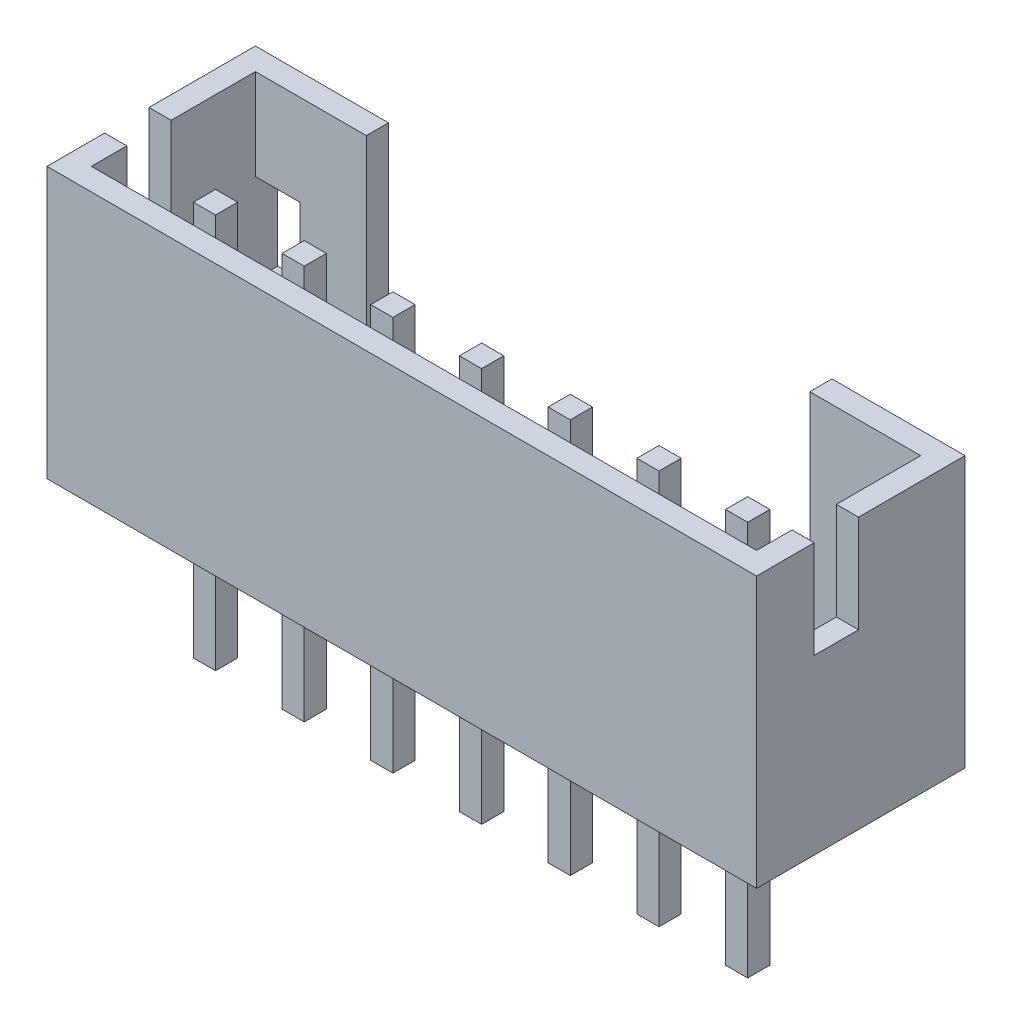
from build123d import *

# Parameters (mm, degrees)
SKETCH1_W         = 16
SKETCH1_H         = 4.7
CASING_DEPTH      = 6.1
CASING_SHELL_T    = -0.5
PINS_DEPTH        = 5
PINS_DEPTH_BACK   = 3.9
SKETCH2_W         = 0.5
SKETCH2_H         = 0.5
PINS_2_DEPTH      = 5
PINS_2_DEPTH_BACK = 3.9
PINS_3_DEPTH      = 5
PINS_3_DEPTH_BACK = 3.9
PINS_4_DEPTH      = 5
PINS_4_DEPTH_BACK = 3.9
PINS_5_DEPTH      = 5
PINS_5_DEPTH_BACK = 3.9
PINS_6_DEPTH      = 5
PINS_6_DEPTH_BACK = 3.9
PINS_7_DEPTH      = 5
PINS_7_DEPTH_BACK = 3.9
SKETCH3_W         = 10
SKETCH3_H         = 4.6
SKETCH3_W_2       = 1
SKETCH3_H_2       = 2
SHAPE_CUT1_DEPTH  = 0.5
SKETCH4_W         = 1
SKETCH4_H         = 2.2
SHAPE_CUT2_DEPTH  = 15.5


with BuildPart() as part:
    # Sketch1 → casing (new body)
    with BuildSketch(Plane(origin=(0, 0, 0), x_dir=(1, 0, 0), z_dir=(0, 1, 0))):
        Rectangle(SKETCH1_W, SKETCH1_H)
    extrude(amount=CASING_DEPTH)

    # casing_shell
    casing_shell_openings = [part.faces().sort_by_distance(p)[0] for p in [
        (0, 6.1, 0),
    ]]
    offset(amount=CASING_SHELL_T, openings=casing_shell_openings, kind=Kind.INTERSECTION)

    # Sketch3 → shape_cut1 (cut)
    with BuildSketch(Plane(origin=(0, 0, -2.35), x_dir=(-1, 0, 0), z_dir=(0, 0, -1))):
        with Locations((0, 3.8)):
            Rectangle(SKETCH3_W, SKETCH3_H)
        with Locations((-7, 3.05)):
            Rectangle(SKETCH3_W_2, SKETCH3_H_2)
        with Locations((7, 3.05)):
            Rectangle(SKETCH3_W_2, SKETCH3_H_2)
    extrude(amount=-SHAPE_CUT1_DEPTH, mode=Mode.SUBTRACT)

    # Sketch4 → shape_cut2 (cut)
    with BuildSketch(Plane.ZY.offset(8)):
        with Locations((0.55, 5)):
            Rectangle(SKETCH4_W, SKETCH4_H)
    shape_cut2 = extrude(amount=-SHAPE_CUT2_DEPTH, mode=Mode.SUBTRACT)

    # shape_cut2m: shape_cut2 across plane
    add(shape_cut2.mirror(Plane(origin=(0, 0, 0), x_dir=(0, 0, 1), z_dir=(1, 0, 0))), mode=Mode.SUBTRACT)


with BuildPart() as body_2:
    # Sketch2 → pins (new, two sides: drawn at the far end of the back side and taken through both)
    with BuildSketch(Plane(origin=(0, 0.5, 0), x_dir=(1, 0, 0), z_dir=(0, 1, 0)).offset(-PINS_DEPTH_BACK)):
        with Locations((-6, -0.55)):
            Rectangle(SKETCH2_W, SKETCH2_H)
    extrude(amount=PINS_DEPTH + PINS_DEPTH_BACK)


with BuildPart() as body_3:
    # Sketch2 → pins 2 (new, two sides: drawn at the far end of the back side and taken through both)
    with BuildSketch(Plane(origin=(0, 0.5, 0), x_dir=(1, 0, 0), z_dir=(0, 1, 0)).offset(-PINS_2_DEPTH_BACK)):
        with Locations((-4, -0.55)):
            Rectangle(SKETCH2_W, SKETCH2_H)
    extrude(amount=PINS_2_DEPTH + PINS_2_DEPTH_BACK)


with BuildPart() as body_4:
    # Sketch2 → pins 3 (new, two sides: drawn at the far end of the back side and taken through both)
    with BuildSketch(Plane(origin=(0, 0.5, 0), x_dir=(1, 0, 0), z_dir=(0, 1, 0)).offset(-PINS_3_DEPTH_BACK)):
        with Locations((-2, -0.55)):
            Rectangle(SKETCH2_W, SKETCH2_H)
    extrude(amount=PINS_3_DEPTH + PINS_3_DEPTH_BACK)


with BuildPart() as body_5:
    # Sketch2 → pins 4 (new, two sides: drawn at the far end of the back side and taken through both)
    with BuildSketch(Plane(origin=(0, 0.5, 0), x_dir=(1, 0, 0), z_dir=(0, 1, 0)).offset(-PINS_4_DEPTH_BACK)):
        with Locations((0, -0.55)):
            Rectangle(SKETCH2_W, SKETCH2_H)
    extrude(amount=PINS_4_DEPTH + PINS_4_DEPTH_BACK)


with BuildPart() as body_6:
    # Sketch2 → pins 5 (new, two sides: drawn at the far end of the back side and taken through both)
    with BuildSketch(Plane(origin=(0, 0.5, 0), x_dir=(1, 0, 0), z_dir=(0, 1, 0)).offset(-PINS_5_DEPTH_BACK)):
        with Locations((2, -0.55)):
            Rectangle(SKETCH2_W, SKETCH2_H)
    extrude(amount=PINS_5_DEPTH + PINS_5_DEPTH_BACK)


with BuildPart() as body_7:
    # Sketch2 → pins 6 (new, two sides: drawn at the far end of the back side and taken through both)
    with BuildSketch(Plane(origin=(0, 0.5, 0), x_dir=(1, 0, 0), z_dir=(0, 1, 0)).offset(-PINS_6_DEPTH_BACK)):
        with Locations((4, -0.55)):
            Rectangle(SKETCH2_W, SKETCH2_H)
    extrude(amount=PINS_6_DEPTH + PINS_6_DEPTH_BACK)


with BuildPart() as body_8:
    # Sketch2 → pins 7 (new, two sides: drawn at the far end of the back side and taken through both)
    with BuildSketch(Plane(origin=(0, 0.5, 0), x_dir=(1, 0, 0), z_dir=(0, 1, 0)).offset(-PINS_7_DEPTH_BACK)):
        with Locations((6, -0.55)):
            Rectangle(SKETCH2_W, SKETCH2_H)
    extrude(amount=PINS_7_DEPTH + PINS_7_DEPTH_BACK)


solid = Compound([part.part, body_2.part, body_3.part, body_4.part, body_5.part, body_6.part, body_7.part, body_8.part])
